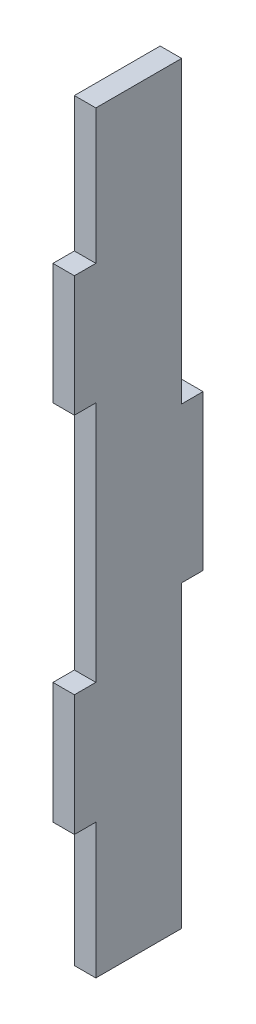
from build123d import *

# Parameters (mm, degrees)
SKETCH1_W           = 18
SKETCH1_H           = 105.4
BOSS_EXTRUDE1_DEPTH = 3
SKETCH3_W           = 3
SKETCH3_H           = 41.865
CUT_EXTRUDE2_DEPTH  = 3
SKETCH5_W           = 3
SKETCH5_H           = 18.88
SKETCH5_H_2         = 33.86
SKETCH5_H_3         = 18.83
CUT_EXTRUDE5_DEPTH  = 3


with BuildPart() as part:
    # Sketch1 → Boss-Extrude1 (new body)
    with BuildSketch(Plane(origin=(0, 0, 0), x_dir=(0, 0, -1), z_dir=(1, 0, 0))):
        Rectangle(SKETCH1_W, SKETCH1_H)
    extrude(amount=BOSS_EXTRUDE1_DEPTH)

    # Sketch3 → Cut-Extrude2 (cut)
    with BuildSketch(Plane(origin=(3, 0, 0), x_dir=(0, 0, -1), z_dir=(1, 0, 0))):
        with Locations((7.5, -31.7675)):
            Rectangle(SKETCH3_W, SKETCH3_H)
        with Locations((7.5, 31.7675)):
            Rectangle(SKETCH3_W, SKETCH3_H)
    extrude(amount=-CUT_EXTRUDE2_DEPTH, mode=Mode.SUBTRACT)

    # Sketch5 → Cut-Extrude5 (cut)
    with BuildSketch(Plane.ZY):
        with Locations((7.5, -43.26)):
            Rectangle(SKETCH5_W, SKETCH5_H)
        with Locations((7.5, 0.04)):
            Rectangle(SKETCH5_W, SKETCH5_H_2)
        with Locations((7.5, 43.285)):
            Rectangle(SKETCH5_W, SKETCH5_H_3)
    extrude(amount=-CUT_EXTRUDE5_DEPTH, mode=Mode.SUBTRACT)


solid = part.part
